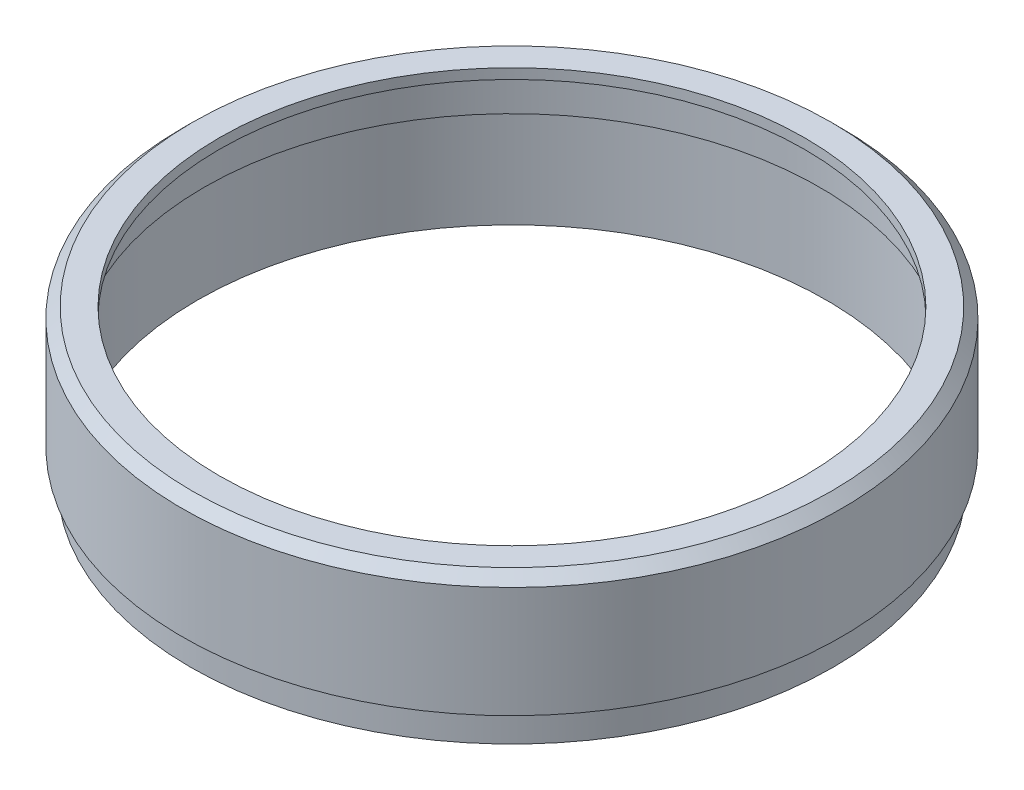
from build123d import *


with BuildPart() as part:
    # Sketch1 → Revolve1 (revolve)
    with BuildSketch(Plane.XY):
        Polygon((-32.65, 4), (-31.85, 4), (-31.85, 1), (-31.15, 1), (-31.15, 11), (-30.5, 11), (-30.5, 15), (-29, 15), (-29, 16), (-31.65, 16), (-32.65, 15), align=None)
    revolve(axis=Axis((0, 0, 0), (0, -1, 0)))


solid = part.part
